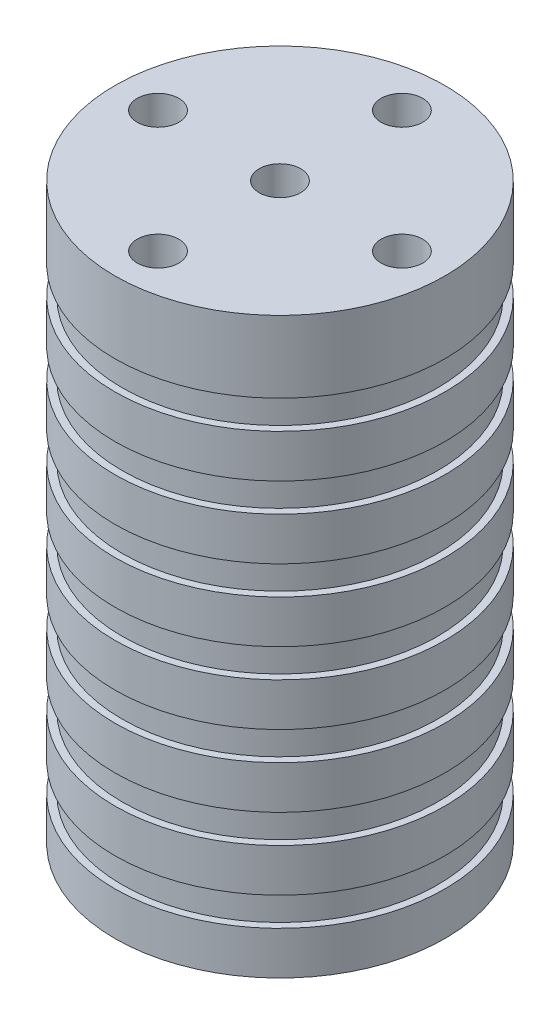
from build123d import *

# Parameters (mm, degrees)
SKETCH3_W                   = 0.5
SKETCH3_H                   = 2
LPATTERN1_COUNT             = 7
LPATTERN1_PITCH             = 5
M3_5X0_6_TAPPED_HOLE1_D     = 2.9
M3_5X0_6_TAPPED_HOLE1_DEPTH = 10
M3_5X0_6_TAPPED_HOLE1_TIP   = 0.871247898


with BuildPart() as part:
    # Sketch2 → Revolve1 (revolve)
    with BuildSketch(Plane.XY, mode=Mode.PRIVATE) as revolve1_sk:
        Polygon((0, 0), (-11.5, 0), (-11.5, -40), (-5.5, -40), (-5.5, -7), (0, -7), align=None)
    revolve(revolve1_sk.sketch.rotate(Axis((0, 0, 0), (0, -1, 0)), 270), axis=Axis((0, 0, 0), (0, -1, 0)))

    # Sketch3 → Cut-Revolve1 (revolve, cut)
    with BuildSketch(Plane.XY, mode=Mode.PRIVATE) as cut_revolve1_sk:
        with Locations((11.25, -36)):
            Rectangle(SKETCH3_W, SKETCH3_H)
    cut_revolve1 = revolve(cut_revolve1_sk.sketch.rotate(Axis((0, 0, 0), (0, -1, 0)), 90), axis=Axis((0, 0, 0), (0, -1, 0)), mode=Mode.SUBTRACT)

    # LPattern1: Cut-Revolve1 ×7
    with Locations(*[(0, i * LPATTERN1_PITCH, 0) for i in range(1, LPATTERN1_COUNT)]):
        add(cut_revolve1, mode=Mode.SUBTRACT)

    # M3.5x0.6 Tapped Hole1
    with Locations(Plane(origin=(0, 0, 0), x_dir=(1, 0, 0), z_dir=(0, 1, 0))):
        with Locations((8.5, 0), (0, 0), (-8.5, 0), (0, 8.5), (0, -8.5)):
            Hole(M3_5X0_6_TAPPED_HOLE1_D / 2, depth=M3_5X0_6_TAPPED_HOLE1_DEPTH)
            with Locations((0, 0, -(M3_5X0_6_TAPPED_HOLE1_DEPTH + M3_5X0_6_TAPPED_HOLE1_TIP / 2))):  # 118° drill point
                Cone(0, M3_5X0_6_TAPPED_HOLE1_D / 2, M3_5X0_6_TAPPED_HOLE1_TIP, mode=Mode.SUBTRACT)


solid = part.part
